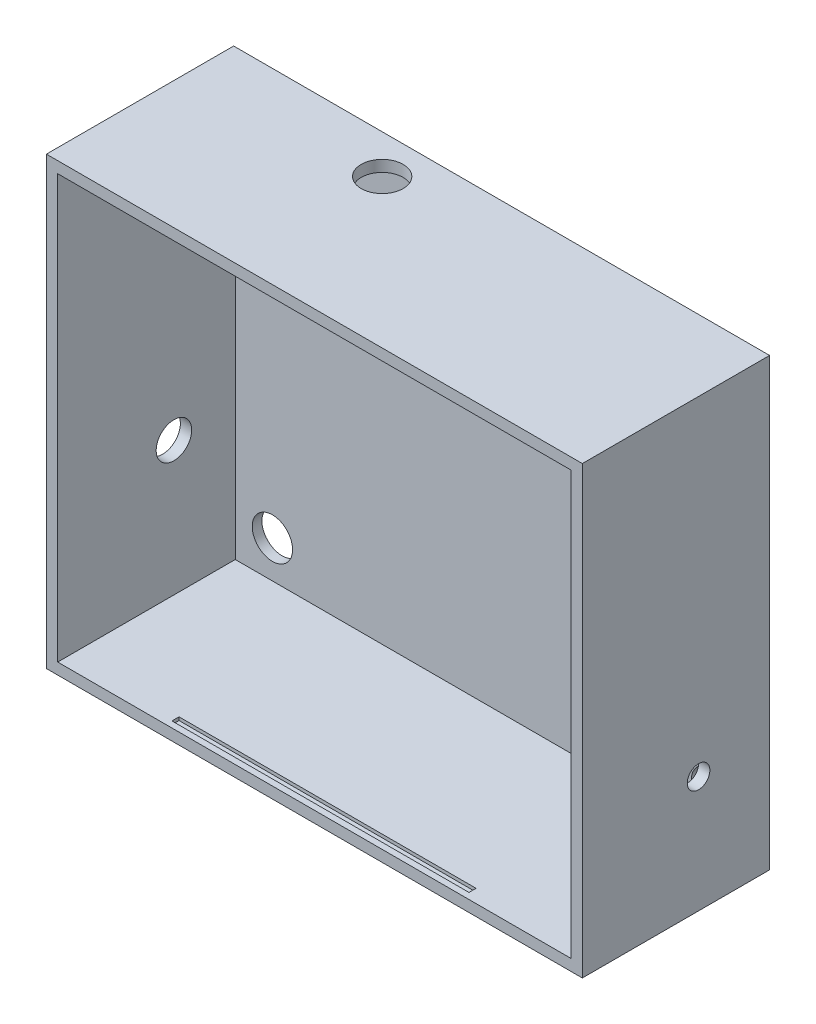
from build123d import *

# Parameters (mm, degrees)
SKETCH_1_W          = 166
SKETCH_1_H          = 138
EXTRUDE_1_DEPTH     = 3
SKETCH_2_W          = 166
SKETCH_2_H          = 138
SKETCH_2_W_2        = 159
SKETCH_2_H_2        = 131
EXTRUDE_2_DEPTH     = 55
CUT_EXTRUDE_4_REACH = 123.14
SKETCH_3_R          = 6.25
SKETCH_4_W          = 92
SKETCH_4_H          = 2.2
CUT_EXTRUDE_5_DEPTH = 1
SKETCH_5_W          = 92
SKETCH_5_H          = 2.2
CUT_EXTRUDE_6_DEPTH = 1
SKETCH_6_R          = 6.5
CUT_EXTRUDE_7_DEPTH = 10
SKETCH_7_R          = 5.5
CUT_EXTRUDE_8_DEPTH = 10
SKETCH_8_R          = 3.5
CUT_EXTRUDE_9_DEPTH = 10


with BuildPart() as part:
    # 스케치1 → 보스-돌출1 (new body)
    with BuildSketch(Plane.XY):
        Rectangle(SKETCH_1_W, SKETCH_1_H)
    extrude(amount=EXTRUDE_1_DEPTH)

    # 스케치2 → 보스-돌출2 (add)
    with BuildSketch(Plane.XY.offset(3)):
        Rectangle(SKETCH_2_W, SKETCH_2_H)
        Rectangle(SKETCH_2_W_2, SKETCH_2_H_2, mode=Mode.SUBTRACT)
    extrude(amount=EXTRUDE_2_DEPTH)

    # 스케치3 → 컷-돌출4 (cut, up to next)
    with BuildSketch(Plane.XY.offset(3), mode=Mode.PRIVATE) as cut_extrude_4_sk1:
        with Locations((-68, 54)):
            Circle(SKETCH_3_R)
    cut_extrude_4_tool1 = extrude(cut_extrude_4_sk1.sketch, amount=-CUT_EXTRUDE_4_REACH, mode=Mode.PRIVATE) & part.part
    # 스케치3 → 컷-돌출4 (cut, up to next)
    with BuildSketch(Plane.XY.offset(3), mode=Mode.PRIVATE) as cut_extrude_4_sk2:
        with Locations((-68, -54)):
            Circle(SKETCH_3_R)
    cut_extrude_4_tool2 = extrude(cut_extrude_4_sk2.sketch, amount=-CUT_EXTRUDE_4_REACH, mode=Mode.PRIVATE) & part.part
    # 스케치3 → 컷-돌출4 (cut, up to next)
    with BuildSketch(Plane.XY.offset(3), mode=Mode.PRIVATE) as cut_extrude_4_sk3:
        with Locations((68, -54)):
            Circle(SKETCH_3_R)
    cut_extrude_4_tool3 = extrude(cut_extrude_4_sk3.sketch, amount=-CUT_EXTRUDE_4_REACH, mode=Mode.PRIVATE) & part.part
    # 스케치3 → 컷-돌출4 (cut, up to next)
    with BuildSketch(Plane.XY.offset(3), mode=Mode.PRIVATE) as cut_extrude_4_sk4:
        with Locations((68, 54)):
            Circle(SKETCH_3_R)
    cut_extrude_4_tool4 = extrude(cut_extrude_4_sk4.sketch, amount=-CUT_EXTRUDE_4_REACH, mode=Mode.PRIVATE) & part.part
    add(cut_extrude_4_tool1.solids().sort_by_distance((-68, 54, 3))[0], mode=Mode.SUBTRACT)
    add(cut_extrude_4_tool2.solids().sort_by_distance((-68, -54, 3))[0], mode=Mode.SUBTRACT)
    add(cut_extrude_4_tool3.solids().sort_by_distance((68, -54, 3))[0], mode=Mode.SUBTRACT)
    add(cut_extrude_4_tool4.solids().sort_by_distance((68, 54, 3))[0], mode=Mode.SUBTRACT)

    # 스케치4 → 컷-돌출5 (cut)
    with BuildSketch(Plane.XZ.offset(-65.5)):
        with Locations((0, 55)):
            Rectangle(SKETCH_4_W, SKETCH_4_H)
    extrude(amount=-CUT_EXTRUDE_5_DEPTH, mode=Mode.SUBTRACT)

    # 스케치5 → 컷-돌출6 (cut)
    with BuildSketch(Plane(origin=(0, -65.5, 0), x_dir=(1, 0, 0), z_dir=(0, 1, 0))):
        with Locations((-0.014955436, -55)):
            Rectangle(SKETCH_5_W, SKETCH_5_H)
    extrude(amount=-CUT_EXTRUDE_6_DEPTH, mode=Mode.SUBTRACT)

    # 스케치6 → 컷-돌출7 (cut)
    with BuildSketch(Plane(origin=(0, 69, 0), x_dir=(1, 0, 0), z_dir=(0, 1, 0))):
        with Locations(Location((-25, -12, 0), (0, 0, 270))):
            Circle(SKETCH_6_R)
    extrude(amount=-CUT_EXTRUDE_7_DEPTH, mode=Mode.SUBTRACT)

    # 스케치7 → 컷-돌출8 (cut)
    with BuildSketch(Plane.ZY.offset(83)):
        with Locations((22, -24)):
            Circle(SKETCH_7_R)
    extrude(amount=-CUT_EXTRUDE_8_DEPTH, mode=Mode.SUBTRACT)

    # 스케치8 → 컷-돌출9 (cut)
    with BuildSketch(Plane(origin=(83, 0, 0), x_dir=(0, 0, -1), z_dir=(1, 0, 0))):
        with Locations((-22, -33)):
            Circle(SKETCH_8_R)
    extrude(amount=-CUT_EXTRUDE_9_DEPTH, mode=Mode.SUBTRACT)


solid = part.part
